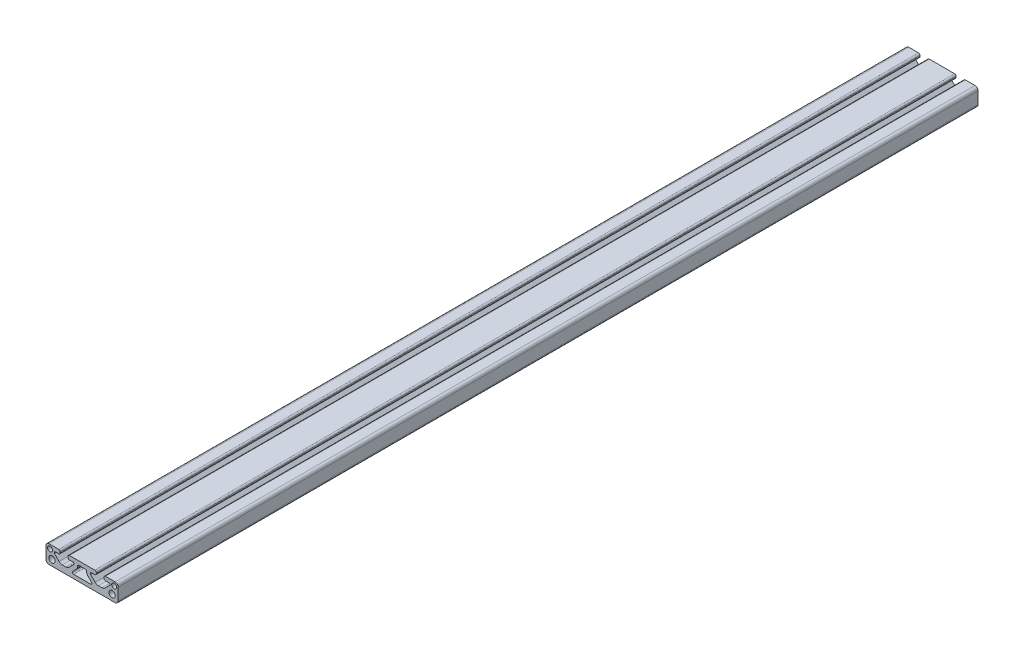
from build123d import *

# Parameters (mm, degrees)
SKETCH1_R      = 2.6035
SKETCH1_R_2    = 3.3274
EXTRUDE1_DEPTH = 908.05


with BuildPart() as part:
    # Sketch1 → Extrude1 (new body)
    with BuildSketch(Plane.XY):
        with BuildLine():
            Line((23.114, 17.475199816), (23.114, 16.560799816))
            ThreePointArc((23.114, 16.560799816), (23.575248241, 15.447248057), (24.6888, 14.985999816))
            Line((24.6888, 14.985999816), (28.448, 14.985999816))
            ThreePointArc((28.448, 14.985999816), (29.076617928, 14.725617744), (29.337, 14.096999816))
            Line((29.337, 14.096999816), (29.337, 13.528917816))
            ThreePointArc((29.337, 13.528917816), (29.269328904, 13.188712244), (29.076617928, 12.900299887))
            Line((29.076617928, 12.900299887), (24.305516832, 8.129198791))
            ThreePointArc((24.305516832, 8.129198791), (22.76457081, 7.099571576), (20.946901043, 6.73801458))
            Line((20.946901043, 6.73801458), (17.153098957, 6.73801458))
            ThreePointArc((17.153098957, 6.73801458), (15.33542919, 7.099571576), (13.794483168, 8.129198791))
            Line((13.794483168, 8.129198791), (9.023382072, 12.900299887))
            ThreePointArc((9.023382072, 12.900299887), (8.830671096, 13.188712244), (8.763, 13.528917816))
            Line((8.763, 13.528917816), (8.763, 14.096999816))
            ThreePointArc((8.763, 14.096999816), (9.023382072, 14.725617744), (9.652, 14.985999816))
            Line((9.652, 14.985999816), (13.4112, 14.985999816))
            ThreePointArc((13.4112, 14.985999816), (14.524751759, 15.447248057), (14.986, 16.560799816))
            Line((14.986, 16.560799816), (14.986, 17.475199816))
            ThreePointArc((14.986, 17.475199816), (14.524751759, 18.588751575), (13.4112, 19.049999816))
            Line((13.4112, 19.049999816), (-13.4112, 19.049999816))
            ThreePointArc((-13.4112, 19.049999816), (-14.524751759, 18.588751575), (-14.986, 17.475199816))
            Line((-14.986, 17.475199816), (-14.986, 16.560799816))
            ThreePointArc((-14.986, 16.560799816), (-14.524751759, 15.447248057), (-13.4112, 14.985999816))
            Line((-13.4112, 14.985999816), (-9.652, 14.985999816))
            ThreePointArc((-9.652, 14.985999816), (-9.023382072, 14.725617744), (-8.763, 14.096999816))
            Line((-8.763, 14.096999816), (-8.763, 13.528917816))
            ThreePointArc((-8.763, 13.528917816), (-8.830671096, 13.188712244), (-9.023382072, 12.900299887))
            Line((-9.023382072, 12.900299887), (-13.794483168, 8.129198791))
            ThreePointArc((-13.794483168, 8.129198791), (-15.33542919, 7.099571576), (-17.153098957, 6.73801458))
            Line((-17.153098957, 6.73801458), (-20.946901043, 6.73801458))
            ThreePointArc((-20.946901043, 6.73801458), (-22.76457081, 7.099571576), (-24.305516832, 8.129198791))
            Line((-24.305516832, 8.129198791), (-29.076617928, 12.900299887))
            ThreePointArc((-29.076617928, 12.900299887), (-29.269328904, 13.188712244), (-29.337, 13.528917816))
            Line((-29.337, 13.528917816), (-29.337, 14.096999816))
            ThreePointArc((-29.337, 14.096999816), (-29.076617928, 14.725617744), (-28.448, 14.985999816))
            Line((-28.448, 14.985999816), (-24.6888, 14.985999816))
            ThreePointArc((-24.6888, 14.985999816), (-23.575248241, 15.447248057), (-23.114, 16.560799816))
            Line((-23.114, 16.560799816), (-23.114, 17.475199816))
            ThreePointArc((-23.114, 17.475199816), (-23.575248241, 18.588751575), (-24.6888, 19.049999816))
            Line((-24.6888, 19.049999816), (-34.925, 19.049999816))
            ThreePointArc((-34.925, 19.049999816), (-37.17006403, 18.120063846), (-38.1, 15.874999816))
            Line((-38.1, 15.874999816), (-38.1, 3.175))
            ThreePointArc((-38.1, 3.175), (-37.17006403, 0.92993597), (-34.925, 0))
            Line((-34.925, 0), (34.925, 0))
            ThreePointArc((34.925, 0), (37.17006403, 0.92993597), (38.1, 3.175))
            Line((38.1, 3.175), (38.1, 15.874999816))
            ThreePointArc((38.1, 15.874999816), (37.17006403, 18.120063846), (34.925, 19.049999816))
            Line((34.925, 19.049999816), (24.6888, 19.049999816))
            ThreePointArc((24.6888, 19.049999816), (23.575248241, 18.588751575), (23.114, 17.475199816))
        make_face()
        with Locations((-33.909, 14.8082)):
            Circle(SKETCH1_R, mode=Mode.SUBTRACT)
        with Locations((31.75, 6.35)):
            Circle(SKETCH1_R_2, mode=Mode.SUBTRACT)
        with Locations((33.909, 14.8082)):
            Circle(SKETCH1_R, mode=Mode.SUBTRACT)
        with Locations((-31.75, 6.35)):
            Circle(SKETCH1_R_2, mode=Mode.SUBTRACT)
        with BuildLine():
            Line((-9.944292429, 6.232025428), (-6.090184211, 10.086133646))
            ThreePointArc((-6.090184211, 10.086133646), (-5.060556996, 11.627079669), (-4.699, 13.444749436))
            Line((-4.699, 13.444749436), (-4.699, 13.715999816))
            ThreePointArc((-4.699, 13.715999816), (-4.327025612, 14.614025428), (-3.429, 14.985999816))
            Line((-3.429, 14.985999816), (3.429, 14.985999816))
            ThreePointArc((3.429, 14.985999816), (4.327025612, 14.614025428), (4.699, 13.715999816))
            Line((4.699, 13.715999816), (4.699, 13.444749436))
            ThreePointArc((4.699, 13.444749436), (5.060556996, 11.627079669), (6.090184211, 10.086133646))
            Line((6.090184211, 10.086133646), (9.944292429, 6.232025428))
            ThreePointArc((9.944292429, 6.232025428), (10.219593823, 4.847991857), (9.046266817, 4.063999816))
            Line((9.046266817, 4.063999816), (-9.046266817, 4.063999816))
            ThreePointArc((-9.046266817, 4.063999816), (-10.219593823, 4.847991857), (-9.944292429, 6.232025428))
        make_face(mode=Mode.SUBTRACT)
    extrude(amount=-EXTRUDE1_DEPTH)


solid = part.part
